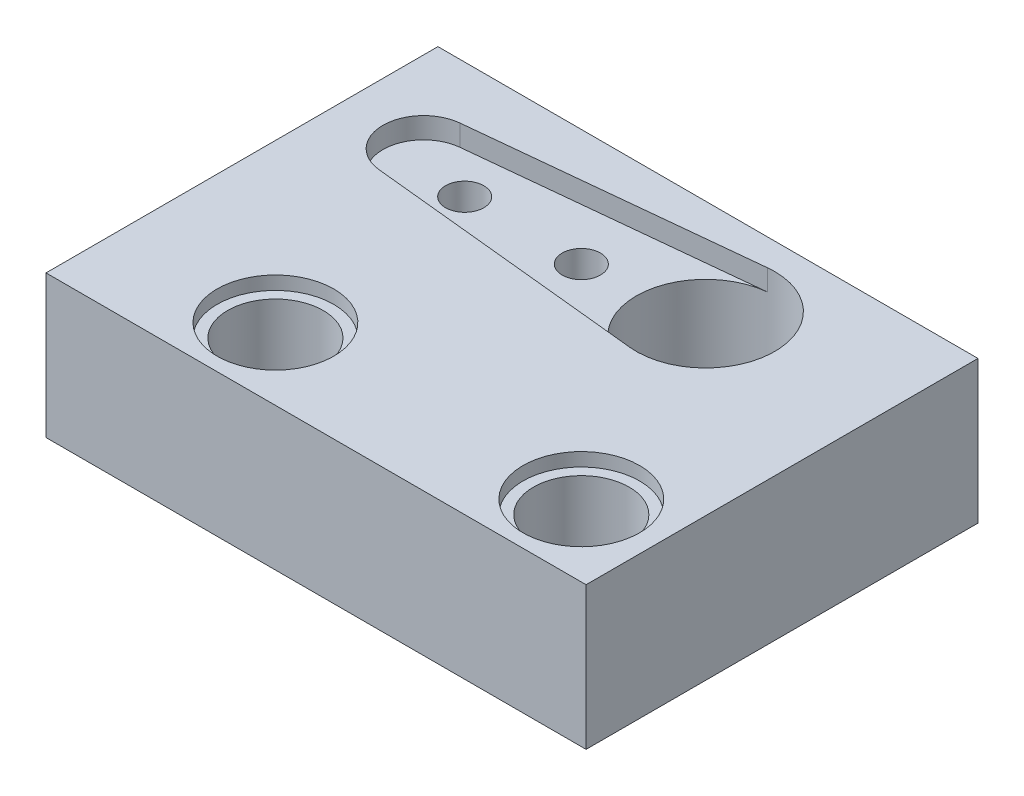
from build123d import *
from build123d.topology import SkipClean

# Parameters (mm, degrees)
SKETCH1_W           = 28.25
SKETCH1_H           = 20.5
SKETCH1_R           = 2.5
BOSS_EXTRUDE1_DEPTH = 7.46
CUT_EXTRUDE2_DEPTH  = 1.1
SKETCH5_R           = 1
SKETCH5_R_2         = 3.62054265
CUT_EXTRUDE3_DEPTH  = 26.331790304
SKETCH6_R           = 3.05
CUT_EXTRUDE4_DEPTH  = 0.7
CUT_EXTRUDE5_START  = -0.7
SKETCH7_R           = 3.05
CUT_EXTRUDE5_DEPTH  = 0.7


with BuildPart() as part:
    # Sketch1 → Boss-Extrude1 (new body)
    with BuildSketch(Plane(origin=(0, 0, 0), x_dir=(1, 0, 0), z_dir=(0, 1, 0))):
        with Locations((-4.875, 5.25)):
            Rectangle(SKETCH1_W, SKETCH1_H)
        with Locations(Location((5.25, 11.75, 0), (0, 0, 90))):
            Circle(SKETCH1_R, mode=Mode.SUBTRACT)
        with Locations(Location((-10.75, 11.75, 0), (0, 0, 90))):
            Circle(SKETCH1_R, mode=Mode.SUBTRACT)
    extrude(amount=BOSS_EXTRUDE1_DEPTH)

    # Sketch3 → Cut-Extrude2 (cut)
    with BuildSketch(Plane(origin=(0, 7.46, 0), x_dir=(1, 0, 0), z_dir=(0, 1, 0))):
        with BuildLine():
            Line((-14.965459534, 2.114048767), (-0.367096675, 3.601884106))
            ThreePointArc((-0.367096675, 3.601884106), (3.62054265, 0), (-0.367096675, -3.601884106))
            Line((-0.367096675, -3.601884106), (-14.965459534, -2.114048767))
            ThreePointArc((-14.965459534, -2.114048767), (-16.875, 0), (-14.965459534, 2.114048767))
        make_face()
    extrude(amount=-CUT_EXTRUDE2_DEPTH, mode=Mode.SUBTRACT)

    # Sketch5 → Cut-Extrude3 (cut, through all)
    with SkipClean():  # the faces are left unmerged after this step: merging them gives an invalid solid
        with BuildSketch(Plane(origin=(0, 6.36, 0), x_dir=(1, 0, 0), z_dir=(0, 1, 0))):
            with Locations(Location((-12.6, 0, 0), (0, 0, 270))):
                Circle(SKETCH5_R)
            with Locations(Location((-6.5, 0, 0), (0, 0, 270))):
                Circle(SKETCH5_R)
            with Locations(Location((0, 0, 0), (0, 0, 270))):
                Circle(SKETCH5_R_2)
        extrude(amount=-CUT_EXTRUDE3_DEPTH, mode=Mode.SUBTRACT)

    # Sketch6 → Cut-Extrude4 (cut)
    with SkipClean():  # the faces are left unmerged after this step: merging them gives an invalid solid
        with BuildSketch(Plane(origin=(0, 7.46, 0), x_dir=(1, 0, 0), z_dir=(0, 1, 0))):
            with Locations(Location((-10.75, 11.75, 0), (0, 0, 270))):
                Circle(SKETCH6_R)
            with Locations(Location((5.25, 11.75, 0), (0, 0, 270))):
                Circle(SKETCH6_R)
        extrude(amount=-CUT_EXTRUDE4_DEPTH, mode=Mode.SUBTRACT)

    # Sketch7 → Cut-Extrude5 (cut)
    with SkipClean():  # the faces are left unmerged after this step: merging them gives an invalid solid
        with BuildSketch(Plane.XZ.offset(CUT_EXTRUDE5_START)):
            with Locations(Location((5.25, -11.75, 0), (0, 0, 90))):
                Circle(SKETCH7_R)
            with Locations(Location((-10.75, -11.75, 0), (0, 0, 90))):
                Circle(SKETCH7_R)
        extrude(amount=CUT_EXTRUDE5_DEPTH, mode=Mode.SUBTRACT)


with BuildPart() as body_2:
    # Mirror2: mirrored copy
    add(part.part.mirror(Plane(origin=(9.25, 7.46, -15.5), x_dir=(1, 0, 0), z_dir=(0, 0, 1))))


solid = body_2.part
